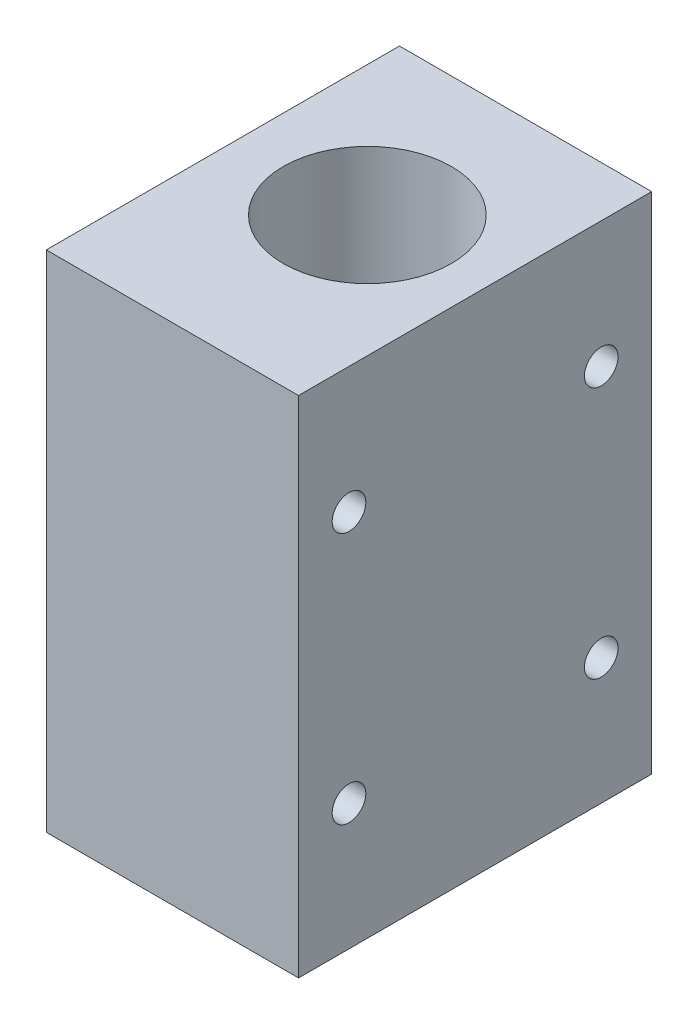
from build123d import *

# Parameters (mm, degrees)
SKETCH1_W           = 42
SKETCH1_H           = 60
BOSS_EXTRUDE1_DEPTH = 30
SKETCH2_R           = 10
CUT_EXTRUDE1_DEPTH  = 80.14543575
SKETCH3_R           = 2
CUT_EXTRUDE2_DEPTH  = 10


with BuildPart() as part:
    # Sketch1 → Boss-Extrude1 (new body)
    with BuildSketch(Plane(origin=(0, 0, 0), x_dir=(0, 0, -1), z_dir=(1, 0, 0))):
        with Locations((21, 30)):
            Rectangle(SKETCH1_W, SKETCH1_H)
    extrude(amount=BOSS_EXTRUDE1_DEPTH)

    # Sketch2 → Cut-Extrude1 (cut, through all)
    with BuildSketch(Plane(origin=(0, 60, 0), x_dir=(1, 0, 0), z_dir=(0, 1, 0))):
        with Locations(Location((15.5, 22.682266583, 0), (0, 0, 270))):
            Circle(SKETCH2_R)
    extrude(amount=-CUT_EXTRUDE1_DEPTH, mode=Mode.SUBTRACT)

    # Sketch3 → Cut-Extrude2 (cut)
    with BuildSketch(Plane(origin=(30, 0, 0), x_dir=(0, 0, -1), z_dir=(1, 0, 0))):
        with Locations((6, 45)):
            Circle(SKETCH3_R)
        with Locations((36, 45)):
            Circle(SKETCH3_R)
        with Locations((36, 15)):
            Circle(SKETCH3_R)
        with Locations((6, 15)):
            Circle(SKETCH3_R)
    extrude(amount=-CUT_EXTRUDE2_DEPTH, mode=Mode.SUBTRACT)


solid = part.part
